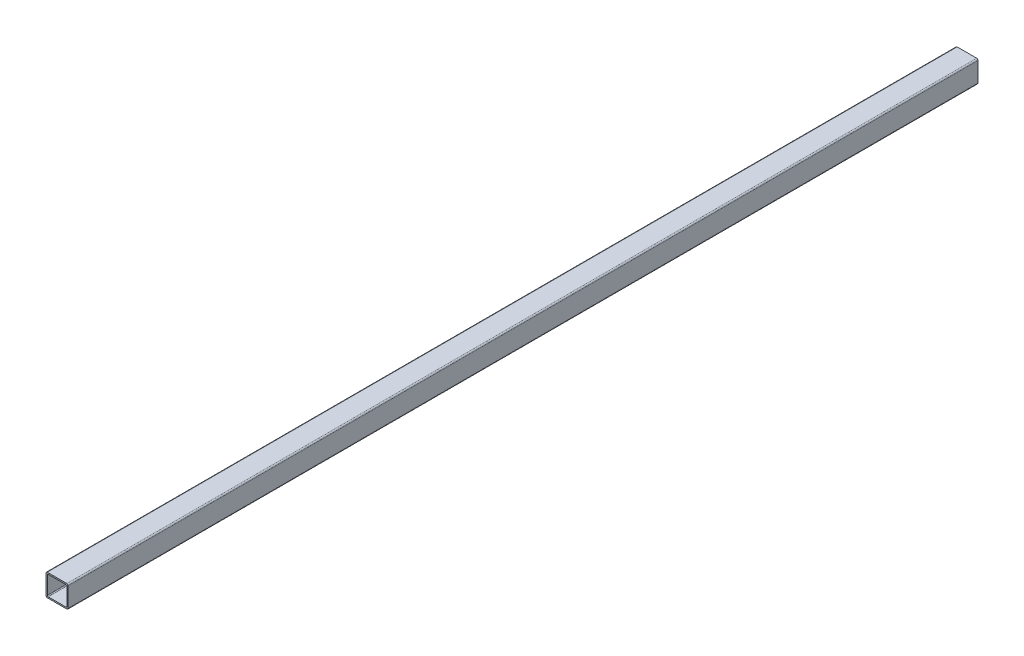
from build123d import *

# Parameters (mm, degrees)
EXTRUDE_1_DEPTH = 2054.330661


with BuildPart() as part:
    # Эскиз1 → Бобышка-Вытянуть1 (new body)
    with BuildSketch(Plane.XY):
        with BuildLine():
            Line((-22, 25), (22, 25))
            ThreePointArc((22, 25), (24.121320344, 24.121320344), (25, 22))
            Line((25, 22), (25, -22))
            ThreePointArc((25, -22), (24.121320344, -24.121320344), (22, -25))
            Line((22, -25), (-22, -25))
            ThreePointArc((-22, -25), (-24.121320344, -24.121320344), (-25, -22))
            Line((-25, -22), (-25, 22))
            ThreePointArc((-25, 22), (-24.121320344, 24.121320344), (-22, 25))
        make_face()
        with BuildLine():
            Line((-20, 22), (20, 22))
            ThreePointArc((20, 22), (21.414213562, 21.414213562), (22, 20))
            Line((22, 20), (22, -20))
            ThreePointArc((22, -20), (21.414213562, -21.414213562), (20, -22))
            Line((20, -22), (-20, -22))
            ThreePointArc((-20, -22), (-21.414213562, -21.414213562), (-22, -20))
            Line((-22, -20), (-22, 20))
            ThreePointArc((-22, 20), (-21.414213562, 21.414213562), (-20, 22))
        make_face(mode=Mode.SUBTRACT)
    extrude(amount=-EXTRUDE_1_DEPTH)


solid = part.part
